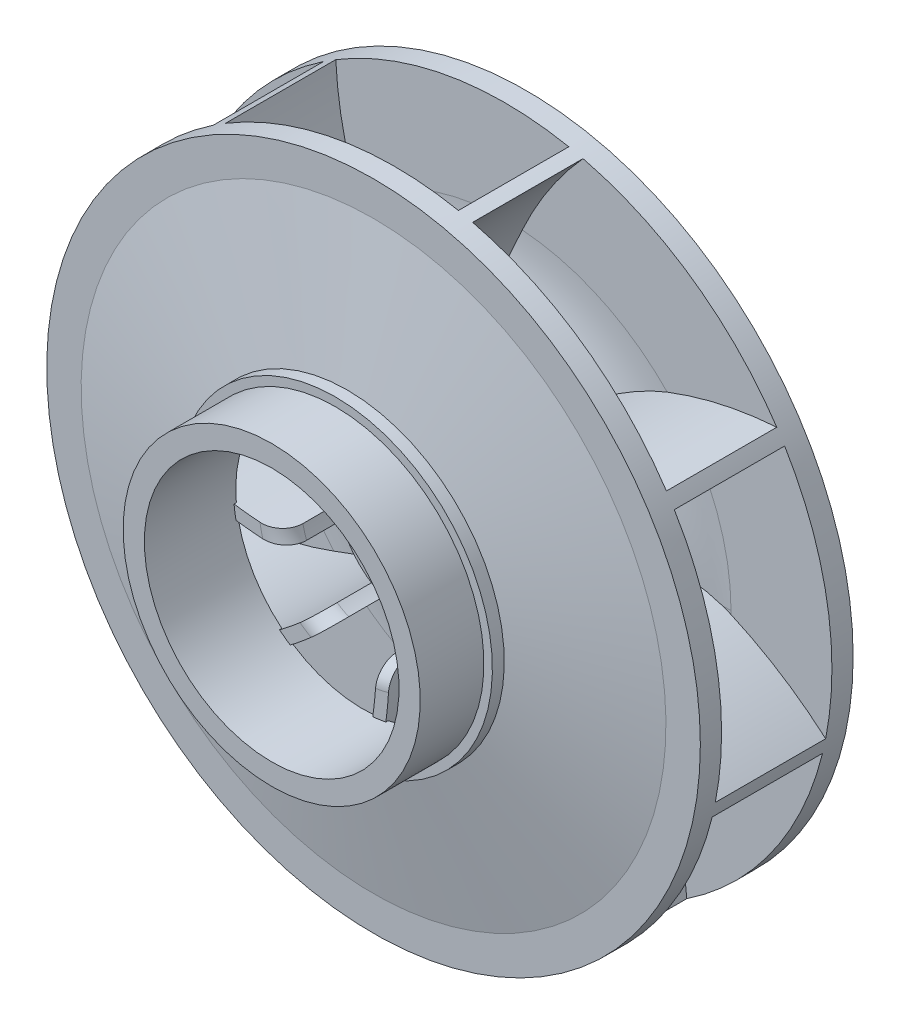
from build123d import *
from build123d.topology import SkipClean

# Parameters (mm, degrees)
BOSS_EXTRUDE1_START      = 34
BOSS_EXTRUDE1_DEPTH      = 34
FILLET1_R                = 5
CIRPATTERN1_COUNT        = 8
FILLET1_OF_CIRPATTERN1_R = 5
CUT_EXTRUDE1_REACH       = 120.604
SKETCH5_W                = 6
SKETCH5_H                = 5


with BuildPart() as part:
    # Sketch1 → Revolve1 (revolve)
    with BuildSketch(Plane(origin=(0, 0, 0), x_dir=(0, 0, -1), z_dir=(1, 0, 0)), mode=Mode.PRIVATE) as revolve1_sk:
        with BuildLine():
            Line((0, 17.5), (0, 9))
            Line((0, 9), (32, 9))
            Line((32, 9), (32, 22))
            Line((32, 22), (27, 22))
            Line((27, 22), (27, 36))
            Line((27, 36), (32, 36))
            Line((32, 36), (32, 37.5))
            Line((32, 37.5), (47, 37.5))
            Line((47, 37.5), (47, 42.5))
            Line((47, 42.5), (27, 42.5))
            Line((27, 42.5), (27, 77))
            Line((27, 77), (22, 77))
            Line((22, 77), (22, 53.221142199))
            ThreePointArc((22, 53.221142199), (16.058772732, 32.244965236), (0, 17.5))
        make_face()
    revolve(revolve1_sk.sketch.rotate(Axis((0, 0, 0), (0, 0, -1)), 90), axis=Axis((0, 0, 0), (0, 0, -1)))

    # Sketch2 → Boss-Extrude1 (add)
    with BuildSketch(Plane.XY.offset(-22).offset(BOSS_EXTRUDE1_START)):
        with BuildLine():
            ThreePointArc((64.011725077, 42.796016786), (33.624870946, 35.130206454), (7.851258512, 17.301957686))
            ThreePointArc((7.851258512, 17.301957686), (9.24733597, 16.597794355), (10.580785698, 15.781222197))
            ThreePointArc((10.580785698, 15.781222197), (36.007766894, 32.907176104), (65.85646563, 39.898946536))
            ThreePointArc((65.85646563, 39.898946536), (64.950250141, 41.357768395), (64.011725077, 42.796016786))
        make_face()
    boss_extrude1 = extrude(amount=-BOSS_EXTRUDE1_DEPTH)

    # Fillet1
    fillet1_edges = [part.edges().sort_by_distance(p)[0] for p in [
        (9.24733597, 16.597794355, 12),
    ]]
    fillet(fillet1_edges, radius=FILLET1_R)

    # CirPattern1: Boss-Extrude1 ×8 about axis
    cirpattern1_axis = Axis((0, 0, 0), (0, 0, 1))
    for i in range(1, CIRPATTERN1_COUNT):
        add(boss_extrude1.rotate(cirpattern1_axis, i * 360 / CIRPATTERN1_COUNT))

    # Fillet1 of CirPattern1
    fillet1_of_cirpattern1_edges = [part.edges().sort_by_distance(p)[0] for p in [
        (-5.197558969, 18.275266914, 12),
        (-16.597794355, 9.24733597, 12),
        (-18.275266914, -5.197558969, 12),
        (-9.24733597, -16.597794355, 12),
        (5.197558969, -18.275266914, 12),
        (16.597794355, -9.24733597, 12),
        (18.275266914, 5.197558969, 12),
    ]]
    fillet(fillet1_of_cirpattern1_edges, radius=FILLET1_OF_CIRPATTERN1_R)

    # Sketch3 → Revolve2 (revolve)
    with SkipClean():  # the faces are left unmerged after this step: merging them gives an invalid solid
        with BuildSketch(Plane(origin=(0, 0, 0), x_dir=(0, 0, -1), z_dir=(1, 0, 0)), mode=Mode.PRIVATE) as revolve2_sk:
            Polygon((-33, 35), (-33, 30), (-11.467078689, 30), (-4, 68.414789658), (-4, 77), (-9, 77), (-9, 68.896234899), (-15.2, 37), (-18, 37), (-18, 35), align=None)
        revolve(revolve2_sk.sketch.rotate(Axis((0, 0, 0), (0, 0, 1)), 270), axis=Axis((0, 0, 0), (0, 0, 1)))

    # Sketch4 → Cut-Revolve1 (revolve, cut)
    with BuildSketch(Plane(origin=(0, 0, 0), x_dir=(0, 0, -1), z_dir=(1, 0, 0))):
        Polygon((-15.2, 37), (-15.2, 77.456022995), (-9, 77.456022995), (-9, 68.896234899), align=None)
    revolve(axis=Axis((0, 0, 0), (0, 0, 1)), mode=Mode.SUBTRACT)

    # Sketch5 → Cut-Extrude1 (cut, up to next)
    with BuildSketch(Plane.XY, mode=Mode.PRIVATE) as cut_extrude1_sk1:
        with Locations((0, 9.3)):
            Rectangle(SKETCH5_W, SKETCH5_H)
    cut_extrude1_tool1 = extrude(cut_extrude1_sk1.sketch, amount=-CUT_EXTRUDE1_REACH, mode=Mode.PRIVATE) & part.part
    add(cut_extrude1_tool1.solids().sort_by_distance((0, 9.3, 0))[0], mode=Mode.SUBTRACT)


solid = part.part
